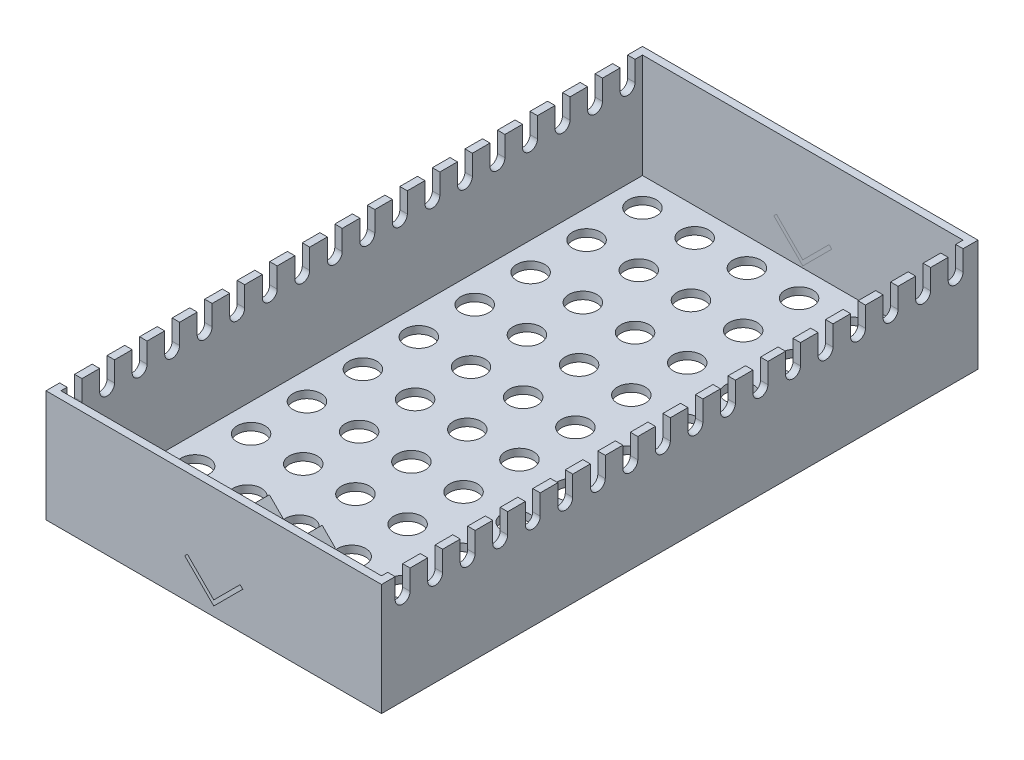
from build123d import *

# Parameters (mm, degrees)
SKETCH1_W                      = 114.3
SKETCH1_H                      = 38.1
BOSS_EXTRUDE1_DEPTH            = 203.2
SHELL1_T                       = -2.54
CUT_EXTRUDE1_REACH             = 216.495
SKETCH3_W                      = 172.72
SKETCH3_H                      = 35.56
CUT_EXTRUDE1_DIRECTION_2_REACH = 216.495
BOSS_EXTRUDE2_DEPTH            = 2.54
CUT_EXTRUDE2_DEPTH             = 237.233655519
CUT_EXTRUDE2_DEPTH_BACK        = 237.233655519
CUT_EXTRUDE3_DEPTH             = 215.058113838
CUT_EXTRUDE3_DEPTH_BACK        = 215.058113838
SKETCH6_R                      = 4.7625
FILLET1_R                      = 2.54
BOSS_EXTRUDE3_DEPTH            = 2.54


with BuildPart() as part:
    # Sketch1 → Boss-Extrude1 (new body)
    with BuildSketch(Plane.XY):
        with Locations((0, 19.05)):
            Rectangle(SKETCH1_W, SKETCH1_H)
        Polygon((0, 4.971051224), (-8.980256121, 13.951307345), (-9.878281733, 13.053281733), (0, 3.175), (9.878281733, 13.053281733), (8.980256121, 13.951307345), align=None, mode=Mode.SUBTRACT)
    extrude(amount=-BOSS_EXTRUDE1_DEPTH)

    # Shell1
    shell1_openings = [part.faces().sort_by_distance(p)[0] for p in [
        (0, 38.1, -101.6),
    ]]
    offset(amount=SHELL1_T, openings=shell1_openings, kind=Kind.INTERSECTION)

    # Sketch3 → Cut-Extrude1 (cut, up to next)
    with BuildSketch(Plane(origin=(0, 0, 0), x_dir=(0, 0, -1), z_dir=(1, 0, 0)), mode=Mode.PRIVATE) as cut_extrude1_sk1:
        with Locations((114.3, 20.32)):
            Rectangle(SKETCH3_W, SKETCH3_H)
    cut_extrude1_tool1 = extrude(cut_extrude1_sk1.sketch, amount=-CUT_EXTRUDE1_REACH, mode=Mode.PRIVATE) & part.part
    add(cut_extrude1_tool1.solids().sort_by_distance((0, 20.32, -114.3))[0], mode=Mode.SUBTRACT)

    # Sketch3 → Cut-Extrude1 direction 2 (cut, up to next)
    with BuildSketch(Plane(origin=(0, 0, 0), x_dir=(0, 0, -1), z_dir=(1, 0, 0)), mode=Mode.PRIVATE) as cut_extrude1_direction_2_sk1:
        with Locations((114.3, 20.32)):
            Rectangle(SKETCH3_W, SKETCH3_H)
    cut_extrude1_direction_2_tool1 = extrude(cut_extrude1_direction_2_sk1.sketch, amount=CUT_EXTRUDE1_DIRECTION_2_REACH, mode=Mode.PRIVATE) & part.part
    add(cut_extrude1_direction_2_tool1.solids().sort_by_distance((0, 20.32, -114.3))[0], mode=Mode.SUBTRACT)

    # Sketch4 → Boss-Extrude2 (add)
    with BuildSketch(Plane(origin=(0, 0, -27.94), x_dir=(-1, 0, 0), z_dir=(0, 0, -1))):
        Polygon((-9.878281733, 13.053281733), (-8.980256121, 13.951307345), (0, 4.971051224), (8.980256121, 13.951307345), (9.878281733, 13.053281733), (0, 3.175), align=None)
    extrude(amount=-BOSS_EXTRUDE2_DEPTH)

    # Sketch5 → Cut-Extrude2 (cut, two sides: drawn at the far end of the back side and taken through both)
    with BuildSketch(Plane.ZY.offset(57.15).offset(-CUT_EXTRUDE2_DEPTH_BACK)):
        with BuildLine():
            Line((-198.12, 38.1), (-193.04, 38.1))
            Line((-193.04, 38.1), (-193.04, 31.242))
            ThreePointArc((-193.04, 31.242), (-195.58, 28.702), (-198.12, 31.242))
            Line((-198.12, 31.242), (-198.12, 38.1))
        make_face()
        with BuildLine():
            Line((-181.957986171, 38.1), (-181.957986171, 31.242))
            ThreePointArc((-181.957986171, 31.242), (-184.497986171, 28.702), (-187.037986171, 31.242))
            Line((-187.037986171, 31.242), (-187.037986171, 38.1))
            Line((-187.037986171, 38.1), (-181.957986171, 38.1))
        make_face()
        with BuildLine():
            Line((-170.875972342, 38.1), (-170.875972342, 31.242))
            ThreePointArc((-170.875972342, 31.242), (-173.415972342, 28.702), (-175.955972342, 31.242))
            Line((-175.955972342, 31.242), (-175.955972342, 38.1))
            Line((-175.955972342, 38.1), (-170.875972342, 38.1))
        make_face()
        with BuildLine():
            Line((-159.793958513, 38.1), (-159.793958513, 31.242))
            ThreePointArc((-159.793958513, 31.242), (-162.333958513, 28.702), (-164.873958513, 31.242))
            Line((-164.873958513, 31.242), (-164.873958513, 38.1))
            Line((-164.873958513, 38.1), (-159.793958513, 38.1))
        make_face()
        with BuildLine():
            Line((-148.711944684, 38.1), (-148.711944684, 31.242))
            ThreePointArc((-148.711944684, 31.242), (-151.251944684, 28.702), (-153.791944684, 31.242))
            Line((-153.791944684, 31.242), (-153.791944684, 38.1))
            Line((-153.791944684, 38.1), (-148.711944684, 38.1))
        make_face()
        with BuildLine():
            Line((-137.629930855, 38.1), (-137.629930855, 31.242))
            ThreePointArc((-137.629930855, 31.242), (-140.169930855, 28.702), (-142.709930855, 31.242))
            Line((-142.709930855, 31.242), (-142.709930855, 38.1))
            Line((-142.709930855, 38.1), (-137.629930855, 38.1))
        make_face()
        with BuildLine():
            Line((-126.547917026, 38.1), (-126.547917026, 31.242))
            ThreePointArc((-126.547917026, 31.242), (-129.087917026, 28.702), (-131.627917026, 31.242))
            Line((-131.627917026, 31.242), (-131.627917026, 38.1))
            Line((-131.627917026, 38.1), (-126.547917026, 38.1))
        make_face()
        with BuildLine():
            Line((-115.465903196, 38.1), (-115.465903196, 31.242))
            ThreePointArc((-115.465903196, 31.242), (-118.005903196, 28.702), (-120.545903196, 31.242))
            Line((-120.545903196, 31.242), (-120.545903196, 38.1))
            Line((-120.545903196, 38.1), (-115.465903196, 38.1))
        make_face()
        with BuildLine():
            Line((-104.383889367, 38.1), (-104.383889367, 31.242))
            ThreePointArc((-104.383889367, 31.242), (-106.923889367, 28.702), (-109.463889367, 31.242))
            Line((-109.463889367, 31.242), (-109.463889367, 38.1))
            Line((-109.463889367, 38.1), (-104.383889367, 38.1))
        make_face()
        with BuildLine():
            Line((-93.301875538, 38.1), (-93.301875538, 31.242))
            ThreePointArc((-93.301875538, 31.242), (-95.841875538, 28.702), (-98.381875538, 31.242))
            Line((-98.381875538, 31.242), (-98.381875538, 38.1))
            Line((-98.381875538, 38.1), (-93.301875538, 38.1))
        make_face()
        with BuildLine():
            Line((-82.219861709, 38.1), (-82.219861709, 31.242))
            ThreePointArc((-82.219861709, 31.242), (-84.759861709, 28.702), (-87.299861709, 31.242))
            Line((-87.299861709, 31.242), (-87.299861709, 38.1))
            Line((-87.299861709, 38.1), (-82.219861709, 38.1))
        make_face()
        with BuildLine():
            Line((-71.13784788, 38.1), (-71.13784788, 31.242))
            ThreePointArc((-71.13784788, 31.242), (-73.67784788, 28.702), (-76.21784788, 31.242))
            Line((-76.21784788, 31.242), (-76.21784788, 38.1))
            Line((-76.21784788, 38.1), (-71.13784788, 38.1))
        make_face()
        with BuildLine():
            Line((-60.055834051, 38.1), (-60.055834051, 31.242))
            ThreePointArc((-60.055834051, 31.242), (-62.595834051, 28.702), (-65.135834051, 31.242))
            Line((-65.135834051, 31.242), (-65.135834051, 38.1))
            Line((-65.135834051, 38.1), (-60.055834051, 38.1))
        make_face()
        with BuildLine():
            Line((-48.973820222, 38.1), (-48.973820222, 31.242))
            ThreePointArc((-48.973820222, 31.242), (-51.513820222, 28.702), (-54.053820222, 31.242))
            Line((-54.053820222, 31.242), (-54.053820222, 38.1))
            Line((-54.053820222, 38.1), (-48.973820222, 38.1))
        make_face()
        with BuildLine():
            Line((-37.891806393, 38.1), (-37.891806393, 31.242))
            ThreePointArc((-37.891806393, 31.242), (-40.431806393, 28.702), (-42.971806393, 31.242))
            Line((-42.971806393, 31.242), (-42.971806393, 38.1))
            Line((-42.971806393, 38.1), (-37.891806393, 38.1))
        make_face()
        with BuildLine():
            Line((-26.809792564, 38.1), (-26.809792564, 31.242))
            ThreePointArc((-26.809792564, 31.242), (-29.349792564, 28.702), (-31.889792564, 31.242))
            Line((-31.889792564, 31.242), (-31.889792564, 38.1))
            Line((-31.889792564, 38.1), (-26.809792564, 38.1))
        make_face()
        with BuildLine():
            Line((-15.727778735, 38.1), (-15.727778735, 31.242))
            ThreePointArc((-15.727778735, 31.242), (-18.267778735, 28.702), (-20.807778735, 31.242))
            Line((-20.807778735, 31.242), (-20.807778735, 38.1))
            Line((-20.807778735, 38.1), (-15.727778735, 38.1))
        make_face()
        with BuildLine():
            Line((-4.645764906, 38.1), (-4.645764906, 31.242))
            ThreePointArc((-4.645764906, 31.242), (-7.185764906, 28.702), (-9.725764906, 31.242))
            Line((-9.725764906, 31.242), (-9.725764906, 38.1))
            Line((-9.725764906, 38.1), (-4.645764906, 38.1))
        make_face()
    extrude(amount=CUT_EXTRUDE2_DEPTH + CUT_EXTRUDE2_DEPTH_BACK, mode=Mode.SUBTRACT)

    # Sketch6 → Cut-Extrude3 (cut, two sides: drawn at the far end of the back side and taken through both)
    with BuildSketch(Plane(origin=(0, 2.54, 0), x_dir=(1, 0, 0), z_dir=(0, 1, 0)).offset(-CUT_EXTRUDE3_DEPTH_BACK)):
        with Locations(Location((-45.085, 191.135, 0), (0, 0, 180))):
            Circle(SKETCH6_R)
        with Locations(Location((-27.305, 191.135, 0), (0, 0, 180))):
            Circle(SKETCH6_R)
        with Locations(Location((-9.525, 191.135, 0), (0, 0, 180))):
            Circle(SKETCH6_R)
        with Locations(Location((8.255, 191.135, 0), (0, 0, 180))):
            Circle(SKETCH6_R)
        with Locations(Location((26.035, 191.135, 0), (0, 0, 180))):
            Circle(SKETCH6_R)
        with Locations(Location((43.815, 191.135, 0), (0, 0, 180))):
            Circle(SKETCH6_R)
        with Locations(Location((-27.305, 172.085, 0), (0, 0, 180))):
            Circle(SKETCH6_R)
        with Locations(Location((-9.525, 172.085, 0), (0, 0, 180))):
            Circle(SKETCH6_R)
        with Locations(Location((8.255, 172.085, 0), (0, 0, 180))):
            Circle(SKETCH6_R)
        with Locations(Location((26.035, 172.085, 0), (0, 0, 180))):
            Circle(SKETCH6_R)
        with Locations(Location((43.815, 172.085, 0), (0, 0, 180))):
            Circle(SKETCH6_R)
        with Locations(Location((-27.305, 153.035, 0), (0, 0, 180))):
            Circle(SKETCH6_R)
        with Locations(Location((-9.525, 153.035, 0), (0, 0, 180))):
            Circle(SKETCH6_R)
        with Locations(Location((8.255, 153.035, 0), (0, 0, 180))):
            Circle(SKETCH6_R)
        with Locations(Location((26.035, 153.035, 0), (0, 0, 180))):
            Circle(SKETCH6_R)
        with Locations(Location((43.815, 153.035, 0), (0, 0, 180))):
            Circle(SKETCH6_R)
        with Locations(Location((-27.305, 133.985, 0), (0, 0, 180))):
            Circle(SKETCH6_R)
        with Locations(Location((-9.525, 133.985, 0), (0, 0, 180))):
            Circle(SKETCH6_R)
        with Locations(Location((8.255, 133.985, 0), (0, 0, 180))):
            Circle(SKETCH6_R)
        with Locations(Location((26.035, 133.985, 0), (0, 0, 180))):
            Circle(SKETCH6_R)
        with Locations(Location((43.815, 133.985, 0), (0, 0, 180))):
            Circle(SKETCH6_R)
        with Locations(Location((-27.305, 114.935, 0), (0, 0, 180))):
            Circle(SKETCH6_R)
        with Locations(Location((-9.525, 114.935, 0), (0, 0, 180))):
            Circle(SKETCH6_R)
        with Locations(Location((8.255, 114.935, 0), (0, 0, 180))):
            Circle(SKETCH6_R)
        with Locations(Location((26.035, 114.935, 0), (0, 0, 180))):
            Circle(SKETCH6_R)
        with Locations(Location((43.815, 114.935, 0), (0, 0, 180))):
            Circle(SKETCH6_R)
        with Locations(Location((-27.305, 95.885, 0), (0, 0, 180))):
            Circle(SKETCH6_R)
        with Locations(Location((-9.525, 95.885, 0), (0, 0, 180))):
            Circle(SKETCH6_R)
        with Locations(Location((8.255, 95.885, 0), (0, 0, 180))):
            Circle(SKETCH6_R)
        with Locations(Location((26.035, 95.885, 0), (0, 0, 180))):
            Circle(SKETCH6_R)
        with Locations(Location((43.815, 95.885, 0), (0, 0, 180))):
            Circle(SKETCH6_R)
        with Locations(Location((-27.305, 76.835, 0), (0, 0, 180))):
            Circle(SKETCH6_R)
        with Locations(Location((-9.525, 76.835, 0), (0, 0, 180))):
            Circle(SKETCH6_R)
        with Locations(Location((8.255, 76.835, 0), (0, 0, 180))):
            Circle(SKETCH6_R)
        with Locations(Location((26.035, 76.835, 0), (0, 0, 180))):
            Circle(SKETCH6_R)
        with Locations(Location((43.815, 76.835, 0), (0, 0, 180))):
            Circle(SKETCH6_R)
        with Locations(Location((-27.305, 57.785, 0), (0, 0, 180))):
            Circle(SKETCH6_R)
        with Locations(Location((-9.525, 57.785, 0), (0, 0, 180))):
            Circle(SKETCH6_R)
        with Locations(Location((8.255, 57.785, 0), (0, 0, 180))):
            Circle(SKETCH6_R)
        with Locations(Location((26.035, 57.785, 0), (0, 0, 180))):
            Circle(SKETCH6_R)
        with Locations(Location((43.815, 57.785, 0), (0, 0, 180))):
            Circle(SKETCH6_R)
        with Locations(Location((-27.305, 38.735, 0), (0, 0, 180))):
            Circle(SKETCH6_R)
        with Locations(Location((-9.525, 38.735, 0), (0, 0, 180))):
            Circle(SKETCH6_R)
        with Locations(Location((8.255, 38.735, 0), (0, 0, 180))):
            Circle(SKETCH6_R)
        with Locations(Location((26.035, 38.735, 0), (0, 0, 180))):
            Circle(SKETCH6_R)
        with Locations(Location((43.815, 38.735, 0), (0, 0, 180))):
            Circle(SKETCH6_R)
        with Locations(Location((-45.085, 172.085, 0), (0, 0, 180))):
            Circle(SKETCH6_R)
        with Locations(Location((-45.085, 153.035, 0), (0, 0, 180))):
            Circle(SKETCH6_R)
        with Locations(Location((-45.085, 133.985, 0), (0, 0, 180))):
            Circle(SKETCH6_R)
        with Locations(Location((-45.085, 114.935, 0), (0, 0, 180))):
            Circle(SKETCH6_R)
        with Locations(Location((-45.085, 95.885, 0), (0, 0, 180))):
            Circle(SKETCH6_R)
        with Locations(Location((-45.085, 76.835, 0), (0, 0, 180))):
            Circle(SKETCH6_R)
        with Locations(Location((-45.085, 57.785, 0), (0, 0, 180))):
            Circle(SKETCH6_R)
        with Locations(Location((-45.085, 38.735, 0), (0, 0, 180))):
            Circle(SKETCH6_R)
    extrude(amount=CUT_EXTRUDE3_DEPTH + CUT_EXTRUDE3_DEPTH_BACK, mode=Mode.SUBTRACT)

    # Fillet1
    fillet1_edges = [part.edges().sort_by_distance(p)[0] for p in [
        (0, 8.563153673, -15.24),
        (-2.957102448, 2.54, -15.24),
        (2.957102448, 2.54, -15.24),
    ]]
    fillet(fillet1_edges, radius=FILLET1_R)


with BuildPart() as body_2:
    # Sketch7 → Boss-Extrude3 (new body)
    with BuildSketch(Plane(origin=(0, 0, -203.2), x_dir=(-1, 0, 0), z_dir=(0, 0, -1))):
        Polygon((-8.980256121, 13.951307345), (-9.878281733, 13.053281733), (0, 3.175), (9.878281733, 13.053281733), (8.980256121, 13.951307345), (0, 4.971051224), align=None)
    extrude(amount=-BOSS_EXTRUDE3_DEPTH)


solid = Compound([part.part, body_2.part])
